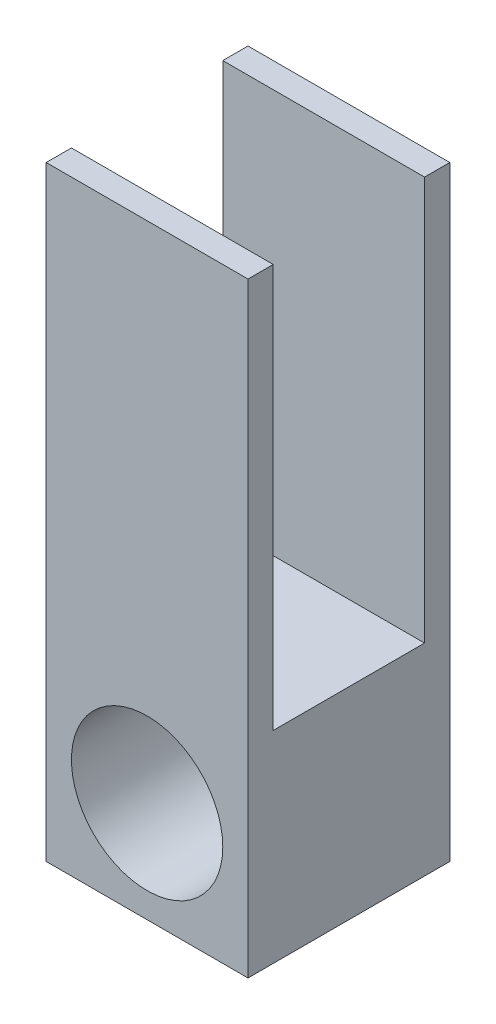
from build123d import *

# Parameters (mm, degrees)
SKETCH2_W           = 6
SKETCH2_H           = 18
BOSS_EXTRUDE1_DEPTH = 6
SKETCH3_R           = 2.25
CUT_EXTRUDE1_DEPTH  = 12.22497216
SKETCH4_W           = 4.5
SKETCH4_H           = 12
CUT_EXTRUDE2_DEPTH  = 13.369316877


with BuildPart() as part:
    # Sketch2 → Boss-Extrude1 (new body)
    with BuildSketch(Plane.XY):
        Rectangle(SKETCH2_W, SKETCH2_H)
    extrude(amount=BOSS_EXTRUDE1_DEPTH)

    # Sketch3 → Cut-Extrude1 (cut, through all)
    with BuildSketch(Plane.XY.offset(6)):
        with Locations((0, -6)):
            Circle(SKETCH3_R)
    extrude(amount=-CUT_EXTRUDE1_DEPTH, mode=Mode.SUBTRACT)

    # Sketch4 → Cut-Extrude2 (cut, through all)
    with BuildSketch(Plane(origin=(3, 0, 0), x_dir=(0, 0, -1), z_dir=(1, 0, 0))):
        with Locations((-3, 3)):
            Rectangle(SKETCH4_W, SKETCH4_H)
    extrude(amount=-CUT_EXTRUDE2_DEPTH, mode=Mode.SUBTRACT)


solid = part.part
